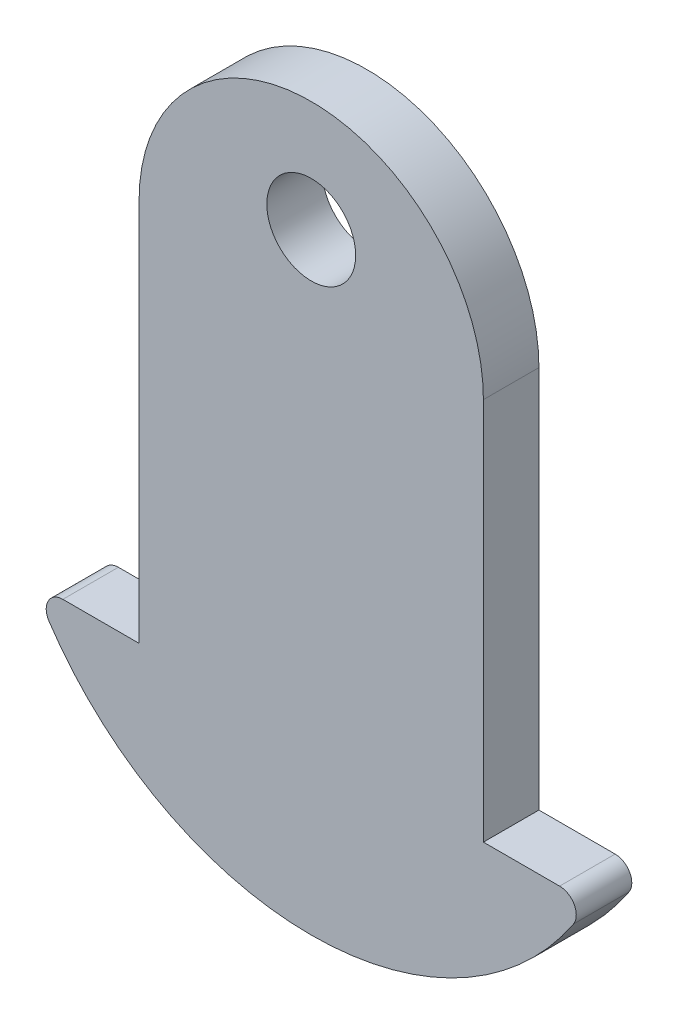
from build123d import *

# Parameters (mm, degrees)
SKETCH1_R           = 2
BOSS_EXTRUDE1_DEPTH = 1.25
FILLET1_R           = 0.75


with BuildPart() as part:
    # Sketch1 → Boss-Extrude1 (new, symmetric)
    with BuildSketch(Plane.XY):
        with BuildLine():
            Line((7.75, 17.25), (7.75, 0))
            Line((7.75, 0), (12.5, 0))
            ThreePointArc((12.5, 0), (0, -7.5), (-12.5, 0))
            Line((-12.5, 0), (-7.75, 0))
            Line((-7.75, 0), (-7.75, 17.25))
            ThreePointArc((-7.75, 17.25), (0, 25), (7.75, 17.25))
        make_face()
        with Locations((0, 20)):
            Circle(SKETCH1_R, mode=Mode.SUBTRACT)
    extrude(amount=BOSS_EXTRUDE1_DEPTH, both=True)

    # Fillet1
    fillet1_edges = [part.edges().sort_by_distance(p)[0] for p in [
        (12.5, 0, 0),
        (-12.5, 0, 0),
    ]]
    fillet(fillet1_edges, radius=FILLET1_R)


solid = part.part
